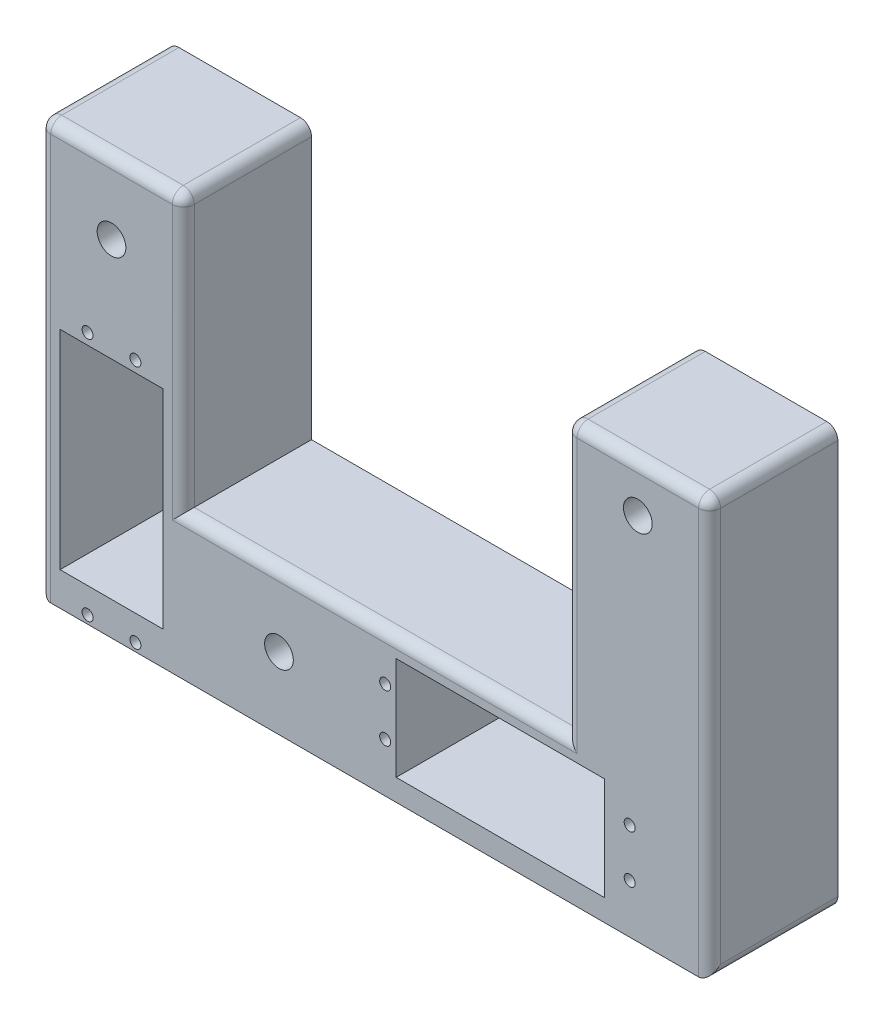
from build123d import *

# Parameters (mm, degrees)
BOSS_EXTRUDE1_DEPTH = 26.8
SKETCH2_W           = 21.5
SKETCH2_H           = 43.5
SKETCH2_W_2         = 43.5
SKETCH2_H_2         = 21.5
CUT_EXTRUDE1_DEPTH  = 157.194070808
SKETCH3_R           = 1.15
BOSS_EXTRUDE2_DEPTH = 26.8
SKETCH3_2_R         = 1.15
CUT_EXTRUDE2_DEPTH  = 157.194070808
SKETCH4_R           = 1.15
CUT_EXTRUDE3_DEPTH  = 157.194070808
FILLET1_R           = 2.3
SKETCH6_R           = 1.75
CUT_EXTRUDE4_DEPTH  = 157.194070808
SKETCH7_R           = 3
CUT_EXTRUDE5_DEPTH  = 5


with BuildPart() as part:
    # Sketch1 → Boss-Extrude1 (new body)
    with BuildSketch(Plane.XY):
        Polygon((86.954468728, 12.865007186), (116.954468728, 12.865007186), (116.954468728, 100), (86.954468728, 100), (86.954468728, 42.865007186), (6.954468728, 42.865007186), (6.954468728, 100), (-23.045531272, 100), (-23.045531272, 12.865007186), (6.954468728, 12.865007186), align=None)
    extrude(amount=BOSS_EXTRUDE1_DEPTH)

    # Sketch2 → Cut-Extrude1 (cut, through all)
    with BuildSketch(Plane.XY.offset(26.8)):
        with Locations((-8.045531272, 41.615007186)):
            Rectangle(SKETCH2_W, SKETCH2_H)
        with Locations((73.204468728, 28.145492547)):
            Rectangle(SKETCH2_W_2, SKETCH2_H_2)
    extrude(amount=-CUT_EXTRUDE1_DEPTH, mode=Mode.SUBTRACT)

    # Sketch3 → Boss-Extrude2 (add, through all)
    with BuildSketch(Plane.XY.offset(26.8)):
        with Locations((-13.045531272, 14.565007186)):
            Circle(SKETCH3_R)
        with Locations((-3.045531272, 14.565007186)):
            Circle(SKETCH3_R)
        with Locations((-13.045531272, 65.665007186)):
            Circle(SKETCH3_R)
        with Locations((-3.045531272, 65.665007186)):
            Circle(SKETCH3_R)
    extrude(amount=-BOSS_EXTRUDE2_DEPTH)

    # Sketch3<2> → Cut-Extrude2 (cut, through all)
    with BuildSketch(Plane.XY.offset(26.8)):
        with Locations((-13.045531272, 14.565007186)):
            Circle(SKETCH3_2_R)
        with Locations((-3.045531272, 14.565007186)):
            Circle(SKETCH3_2_R)
        with Locations((-13.045531272, 65.665007186)):
            Circle(SKETCH3_2_R)
        with Locations(Location((-3.045531272, 65.665007186, 0), (0, 0, 180))):
            Circle(SKETCH3_2_R)
    extrude(amount=-CUT_EXTRUDE2_DEPTH, mode=Mode.SUBTRACT)

    # Sketch4 → Cut-Extrude3 (cut, through all)
    with BuildSketch(Plane.XY.offset(26.8)):
        with Locations((100.254468728, 23.145492547)):
            Circle(SKETCH4_R)
        with Locations(Location((100.254468728, 33.145492547, 0), (0, 0, 180))):
            Circle(SKETCH4_R)
        with Locations((49.154468728, 23.145492547)):
            Circle(SKETCH4_R)
        with Locations(Location((49.154468728, 33.145492547, 0), (0, 0, 180))):
            Circle(SKETCH4_R)
    extrude(amount=-CUT_EXTRUDE3_DEPTH, mode=Mode.SUBTRACT)

    # Fillet1
    fillet1_edges = [part.edges().sort_by_distance(p)[0] for p in [
        (6.954468728, 100, 13.4),
        (86.954468728, 100, 13.4),
        (116.954468728, 100, 13.4),
        (116.954468728, 12.865007186, 13.4),
        (-23.045531272, 12.865007186, 13.4),
        (-23.045531272, 100, 13.4),
        (116.954468728, 56.432503593, 26.8),
        (101.954468728, 100, 26.8),
        (86.954468728, 71.432503593, 26.8),
        (46.954468728, 42.865007186, 26.8),
        (6.954468728, 71.432503593, 26.8),
        (-8.045531272, 100, 26.8),
        (-23.045531272, 56.432503593, 26.8),
    ]]
    fillet(fillet1_edges, radius=FILLET1_R)

    # Sketch6 → Cut-Extrude4 (cut, through all)
    with BuildSketch(Plane.XY):
        with Locations((101.954468728, 90)):
            Circle(SKETCH6_R)
        with Locations((-8.045531272, 85)):
            Circle(SKETCH6_R)
        with Locations((26.954468728, 27.865007186)):
            Circle(SKETCH6_R)
    extrude(amount=CUT_EXTRUDE4_DEPTH, mode=Mode.SUBTRACT)

    # Sketch7 → Cut-Extrude5 (cut)
    with BuildSketch(Plane.XY.offset(26.8)):
        with Locations((-8.045531272, 85)):
            Circle(SKETCH7_R)
        with Locations((26.954468728, 27.865007186)):
            Circle(SKETCH7_R)
        with Locations((101.954468728, 90)):
            Circle(SKETCH7_R)
    extrude(amount=-CUT_EXTRUDE5_DEPTH, mode=Mode.SUBTRACT)


solid = part.part
